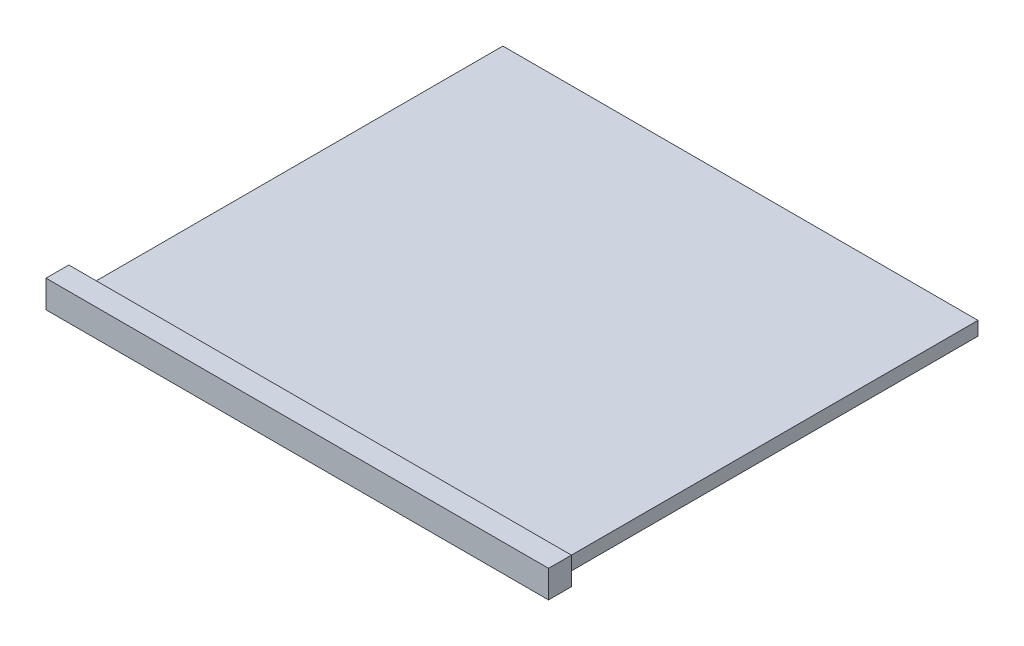
from build123d import *

# Parameters (mm, degrees)
SKETCH1_W           = 104
SKETCH1_H           = 6
BOSS_EXTRUDE1_DEPTH = 5
SKETCH2_W           = 104
SKETCH2_H           = 3
BOSS_EXTRUDE2_DEPTH = 92
SKETCH3_W           = 5
SKETCH3_H           = 6
BOSS_EXTRUDE3_DEPTH = 3
SKETCH4_W           = 5
SKETCH4_H           = 6
BOSS_EXTRUDE4_DEPTH = 3


with BuildPart() as part:
    # Sketch1 → Boss-Extrude1 (new body)
    with BuildSketch(Plane.XY):
        Rectangle(SKETCH1_W, SKETCH1_H)
    extrude(amount=-BOSS_EXTRUDE1_DEPTH)

    # Sketch2 → Boss-Extrude2 (add)
    with BuildSketch(Plane(origin=(0, 0, -5), x_dir=(-1, 0, 0), z_dir=(0, 0, -1))):
        with Locations((0, -1.5)):
            Rectangle(SKETCH2_W, SKETCH2_H)
    extrude(amount=BOSS_EXTRUDE2_DEPTH)

    # Sketch3 → Boss-Extrude3 (add)
    with BuildSketch(Plane(origin=(52, 0, 0), x_dir=(0, 0, -1), z_dir=(1, 0, 0))):
        with Locations((2.5, 0)):
            Rectangle(SKETCH3_W, SKETCH3_H)
    extrude(amount=BOSS_EXTRUDE3_DEPTH)

    # Sketch4 → Boss-Extrude4 (add)
    with BuildSketch(Plane.ZY.offset(52)):
        with Locations((-2.5, 0)):
            Rectangle(SKETCH4_W, SKETCH4_H)
    extrude(amount=BOSS_EXTRUDE4_DEPTH)


solid = part.part
